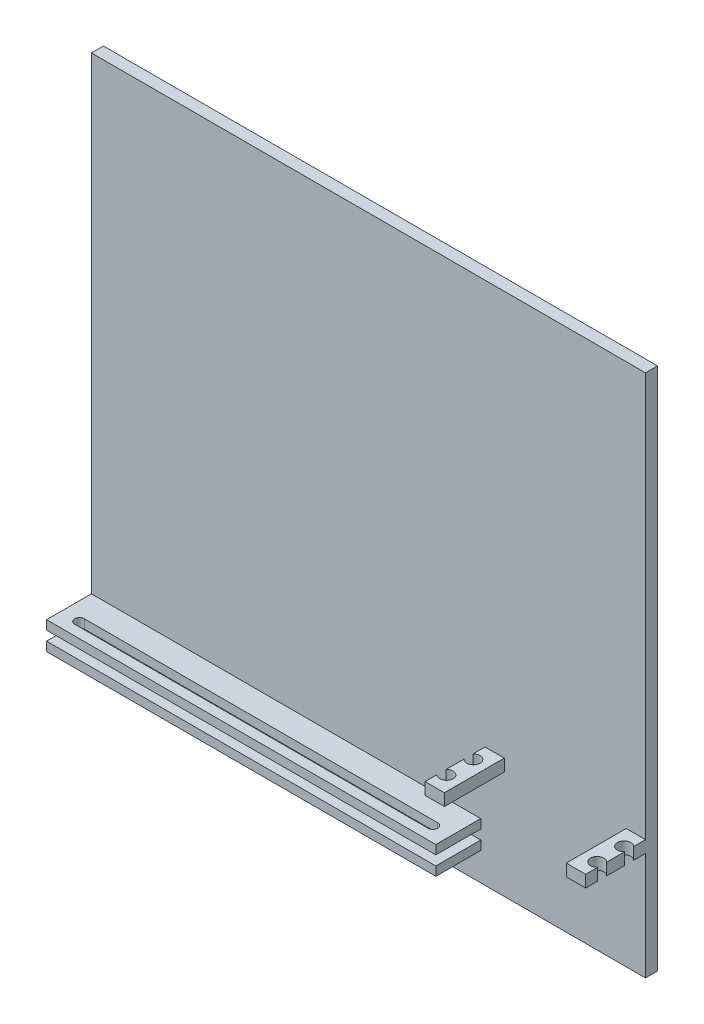
from build123d import *

# Parameters (mm, degrees)
SKETCH_1_W          = 185
SKETCH_1_H          = 175
EXTRUDE_1_DEPTH     = 4
SKETCH_2_W          = 6.45
SKETCH_2_H          = 4
EXTRUDE_2_DEPTH     = 20
CUT_EXTRUDE_1_REACH = 176.157
SKETCH_3_R          = 2.22
SKETCH_4_W          = 130
SKETCH_4_H          = 3
EXTRUDE_3_DEPTH     = 15
CUT_EXTRUDE_2_REACH = 198.044


with BuildPart() as part:
    # 草圖1 → 填料-伸長1 (new body)
    with BuildSketch(Plane.XY):
        with Locations((-9.645986095, 41.11316568)):
            Rectangle(SKETCH_1_W, SKETCH_1_H)
    extrude(amount=EXTRUDE_1_DEPTH)

    # 草圖2 → 填料-伸長2 (add)
    with BuildSketch(Plane.XY.offset(4)):
        with Locations((79.629013905, -8.38683432)):
            Rectangle(SKETCH_2_W, SKETCH_2_H)
        with Locations((32.479013905, -8.38683432)):
            Rectangle(SKETCH_2_W, SKETCH_2_H)
    extrude(amount=EXTRUDE_2_DEPTH)

    # 草圖3 → 除料-伸長1 (cut, up to next)
    with BuildSketch(Plane.XZ.offset(10.38683432), mode=Mode.PRIVATE) as cut_extrude_1_sk1:
        with Locations((81.204013905, 18.5)):
            Circle(SKETCH_3_R)
    cut_extrude_1_tool1 = extrude(cut_extrude_1_sk1.sketch, amount=-CUT_EXTRUDE_1_REACH, mode=Mode.PRIVATE) & part.part
    # 草圖3 → 除料-伸長1 (cut, up to next)
    with BuildSketch(Plane.XZ.offset(10.38683432), mode=Mode.PRIVATE) as cut_extrude_1_sk2:
        with Locations((81.204013905, 9.5)):
            Circle(SKETCH_3_R)
    cut_extrude_1_tool2 = extrude(cut_extrude_1_sk2.sketch, amount=-CUT_EXTRUDE_1_REACH, mode=Mode.PRIVATE) & part.part
    # 草圖3 → 除料-伸長1 (cut, up to next)
    with BuildSketch(Plane.XZ.offset(10.38683432), mode=Mode.PRIVATE) as cut_extrude_1_sk3:
        with Locations((30.904013905, 9.5)):
            Circle(SKETCH_3_R)
    cut_extrude_1_tool3 = extrude(cut_extrude_1_sk3.sketch, amount=-CUT_EXTRUDE_1_REACH, mode=Mode.PRIVATE) & part.part
    # 草圖3 → 除料-伸長1 (cut, up to next)
    with BuildSketch(Plane.XZ.offset(10.38683432), mode=Mode.PRIVATE) as cut_extrude_1_sk4:
        with Locations((30.904013905, 18.5)):
            Circle(SKETCH_3_R)
    cut_extrude_1_tool4 = extrude(cut_extrude_1_sk4.sketch, amount=-CUT_EXTRUDE_1_REACH, mode=Mode.PRIVATE) & part.part
    add(cut_extrude_1_tool1.solids().sort_by_distance((81.204014, -10.386834, 18.5))[0], mode=Mode.SUBTRACT)
    add(cut_extrude_1_tool2.solids().sort_by_distance((81.204014, -10.386834, 9.5))[0], mode=Mode.SUBTRACT)
    add(cut_extrude_1_tool3.solids().sort_by_distance((30.904014, -10.386834, 9.5))[0], mode=Mode.SUBTRACT)
    add(cut_extrude_1_tool4.solids().sort_by_distance((30.904014, -10.386834, 18.5))[0], mode=Mode.SUBTRACT)

    # 草圖4 → 填料-伸長3 (add)
    with BuildSketch(Plane.XY.offset(4)):
        with Locations((-37.145986095, -29.28683432)):
            Rectangle(SKETCH_4_W, SKETCH_4_H)
        with Locations((-37.145986095, -35.48683432)):
            Rectangle(SKETCH_4_W, SKETCH_4_H)
    extrude(amount=EXTRUDE_3_DEPTH)

    # 除料-伸長2: up to this face of the body (flat: up to its plane)
    cut_extrude_2_end = Plane(part.part.faces().sort_by_distance((-37.145986095, -27.78683432, 11.5))[0])
    # 草圖5 → 除料-伸長2 (cut, up to the picked face)
    with BuildSketch(Plane.XZ.offset(36.98683432), mode=Mode.PRIVATE) as cut_extrude_2_sk1:
        with BuildLine():
            Line((-96.145986095, 15.6), (21.854013905, 15.6))
            ThreePointArc((21.854013905, 15.6), (23.454013905, 14), (21.854013905, 12.4))
            Line((21.854013905, 12.4), (-96.145986095, 12.4))
            ThreePointArc((-96.145986095, 12.4), (-97.745986095, 14), (-96.145986095, 15.6))
        make_face()
    cut_extrude_2_tool1 = split(extrude(cut_extrude_2_sk1.sketch, amount=-CUT_EXTRUDE_2_REACH, mode=Mode.PRIVATE), bisect_by=cut_extrude_2_end, keep=Keep.BOTH, mode=Mode.PRIVATE)
    add(cut_extrude_2_tool1.solids().sort_by(Axis((-37.145986, -36.986834, 14), (0, 1, 0)))[0], mode=Mode.SUBTRACT)


solid = part.part
